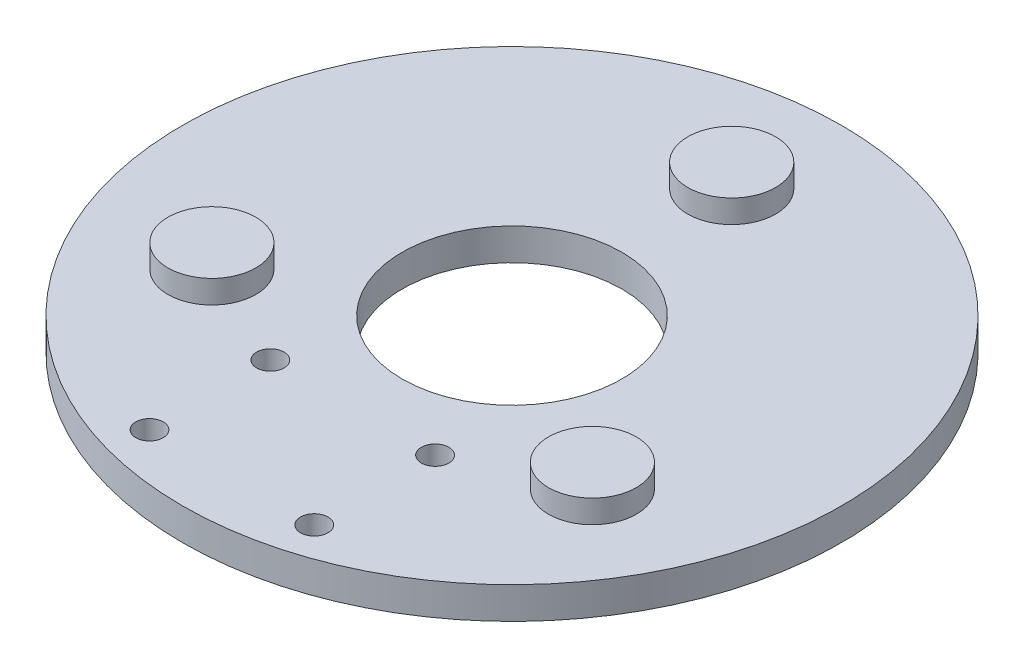
from build123d import *

# Parameters (mm, degrees)
SKETCH1_R           = 76.2
SKETCH1_R_2         = 25.4
BOSS_EXTRUDE1_DEPTH = 7.366
SKETCH2_R           = 10.16
BOSS_EXTRUDE2_DEPTH = 5.334
SKETCH3_R           = 3.175
CUT_EXTRUDE1_DEPTH  = 109.014526597


with BuildPart() as part:
    # Sketch1 → Boss-Extrude1 (new body)
    with BuildSketch(Plane(origin=(0, 0, 0), x_dir=(1, 0, 0), z_dir=(0, 1, 0))):
        with Locations(Location((0, 0, 0), (0, 0, 270))):
            Circle(SKETCH1_R)
        with Locations(Location((0, 0, 0), (0, 0, 270))):
            Circle(SKETCH1_R_2, mode=Mode.SUBTRACT)
    extrude(amount=BOSS_EXTRUDE1_DEPTH)

    # Sketch2 → Boss-Extrude2 (add)
    with BuildSketch(Plane(origin=(0, 7.366, 0), x_dir=(1, 0, 0), z_dir=(0, 1, 0))):
        with Locations(Location((0, 50.8, 0), (0, 0, 270))):
            Circle(SKETCH2_R)
        with Locations(Location((-43.994090512, -25.4, 0), (0, 0, 270))):
            Circle(SKETCH2_R)
        with Locations(Location((43.994090512, -25.4, 0), (0, 0, 270))):
            Circle(SKETCH2_R)
    extrude(amount=BOSS_EXTRUDE2_DEPTH)

    # Sketch3 → Cut-Extrude1 (cut, through all)
    with BuildSketch(Plane(origin=(0, 7.366, 0), x_dir=(1, 0, 0), z_dir=(0, 1, 0))):
        with Locations(Location((-19.05, -64.77, 0), (0, 0, 270))):
            Circle(SKETCH3_R)
        with Locations(Location((19.05, -36.83, 0), (0, 0, 270))):
            Circle(SKETCH3_R)
        with Locations(Location((19.05, -64.77, 0), (0, 0, 90))):
            Circle(SKETCH3_R)
        with Locations(Location((-19.05, -36.83, 0), (0, 0, 90))):
            Circle(SKETCH3_R)
    extrude(amount=-CUT_EXTRUDE1_DEPTH, mode=Mode.SUBTRACT)


solid = part.part
